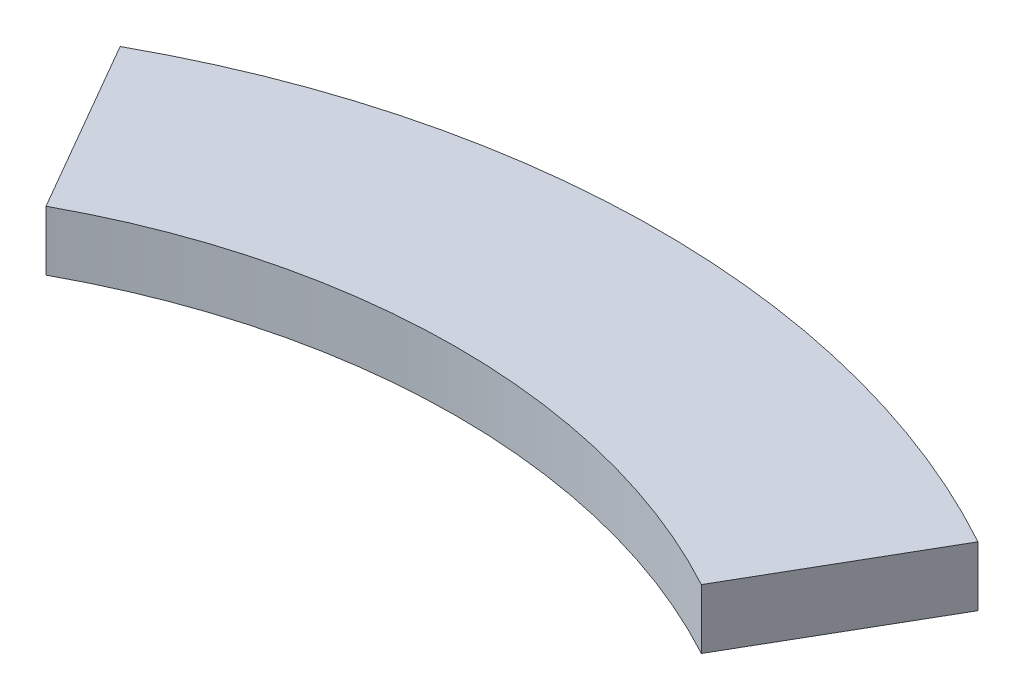
from build123d import *

# Parameters (mm, degrees)
BOSS_EXTRUDE1_DEPTH = 2.5
SKETCH2_R           = 1.625
CUT_EXTRUDE1_DEPTH  = 2


with BuildPart() as part:
    # Sketch1 → Boss-Extrude1 (new body)
    with BuildSketch(Plane(origin=(0, 0, 0), x_dir=(1, 0, 0), z_dir=(0, 1, 0))):
        with BuildLine():
            Line((-17.971705397, 32.627906846), (-13.729256498, 25.279769804))
            ThreePointArc((-13.729256498, 25.279769804), (0, 28.767329478), (13.729256498, 25.279769804))
            Line((13.729256498, 25.279769804), (17.971705397, 32.627906846))
            ThreePointArc((17.971705397, 32.627906846), (0, 37.25), (-17.971705397, 32.627906846))
        make_face()
    extrude(amount=BOSS_EXTRUDE1_DEPTH)

    # Sketch2 → Cut-Extrude1 (cut)
    with BuildSketch(Plane.XZ):
        with Locations(Location((0, -33.008664739, 0), (0, 0, 270))):
            Circle(SKETCH2_R)
    extrude(amount=-CUT_EXTRUDE1_DEPTH, mode=Mode.SUBTRACT)


solid = part.part
